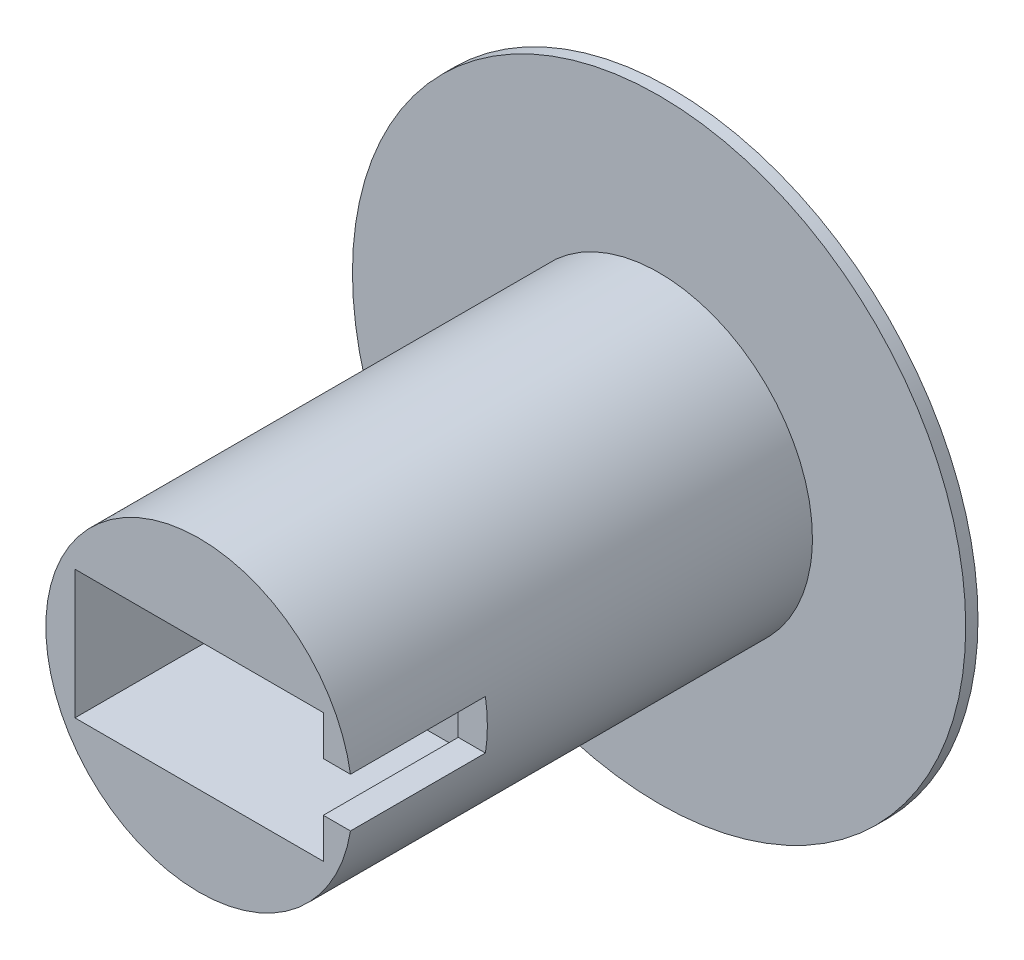
from build123d import *

# Parameters (mm, degrees)
SKETCH1_R           = 50
SKETCH1_R_2         = 25
BOSS_EXTRUDE1_DEPTH = 2
SKETCH1_3_W         = 40.5
SKETCH1_3_H         = 21
BOSS_EXTRUDE2_DEPTH = 50
BOSS_EXTRUDE3_DEPTH = 77
BOSS_EXTRUDE7_DEPTH = 55


with BuildPart() as part:
    # Sketch1 → Boss-Extrude1 (new body)
    with BuildSketch(Plane.XY):
        Circle(SKETCH1_R)
        Circle(SKETCH1_R_2, mode=Mode.SUBTRACT)
    extrude(amount=BOSS_EXTRUDE1_DEPTH)



with BuildPart() as body_2:
    # Sketch1<3> → Boss-Extrude2 (new body)
    with BuildSketch(Plane.XY):
        Rectangle(SKETCH1_3_W, SKETCH1_3_H)
    extrude(amount=BOSS_EXTRUDE2_DEPTH)


with BuildPart() as part_1:
    add(part.part)

    add(body_2.part)  # Boss-Extrude3 merges body 2
    # Sketch1<4> → Boss-Extrude3 (add)
    with BuildSketch(Plane.XY):
        with BuildLine():
            Line((-20.25, -10.5), (-20.25, 10.5))
            Line((-20.25, 10.5), (20.25, 10.5))
            Line((20.25, 10.5), (20.25, 4))
            Line((20.25, 4), (24.677925359, 4))
            ThreePointArc((24.677925359, 4), (-25, 0), (24.677925359, -4))
            Line((24.677925359, -4), (20.25, -4))
            Line((20.25, -4), (20.25, -10.5))
            Line((20.25, -10.5), (-20.25, -10.5))
        make_face()
    extrude(amount=BOSS_EXTRUDE3_DEPTH)

    # Sketch1<7> → Boss-Extrude7 (add)
    with BuildSketch(Plane.XY):
        with BuildLine():
            Line((24.677925359, 4), (20.25, 4))
            Line((20.25, 4), (20.25, -4))
            Line((20.25, -4), (24.677925359, -4))
            ThreePointArc((24.677925359, -4), (24.919351255, -2.00647278), (25, 0))
            ThreePointArc((25, 0), (24.919351255, 2.00647278), (24.677925359, 4))
        make_face()
    extrude(amount=BOSS_EXTRUDE7_DEPTH)


solid = part_1.part
